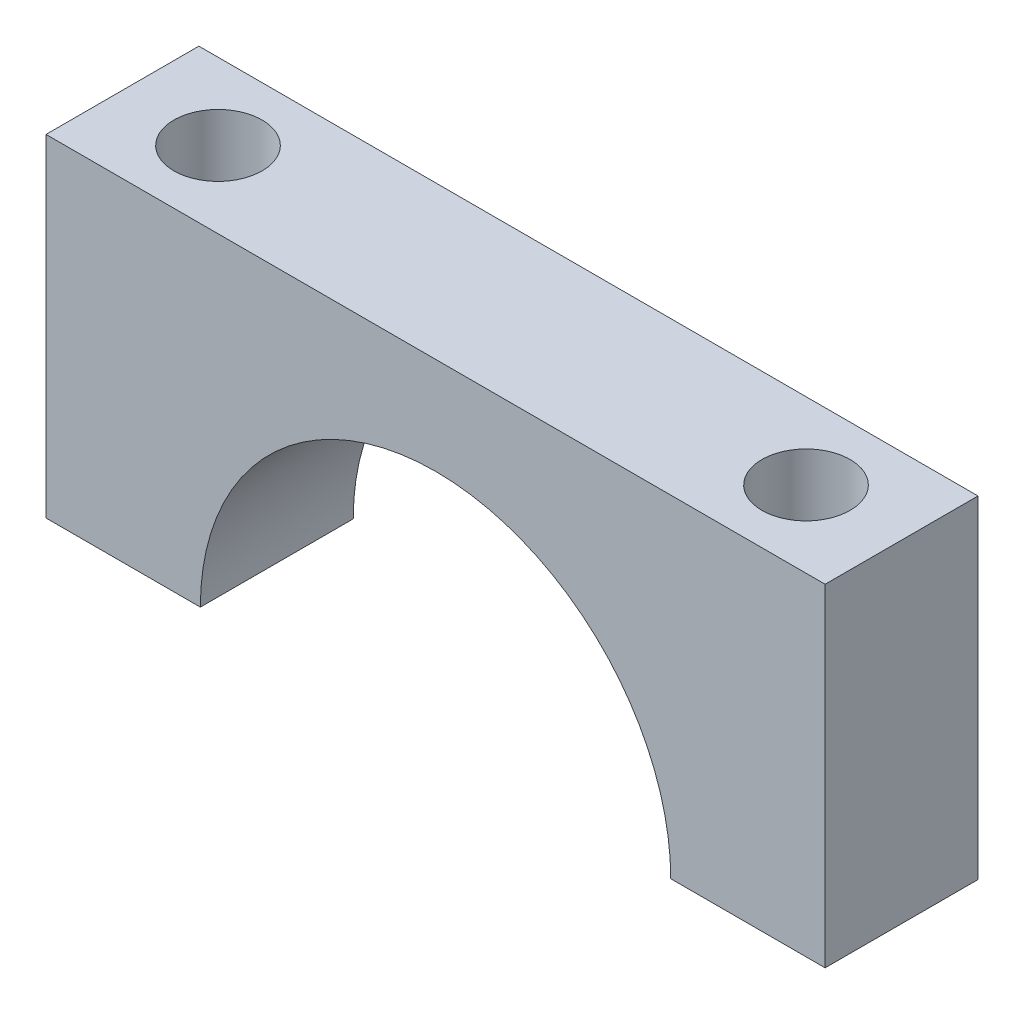
from build123d import *

# Parameters (mm, degrees)
BOSS_EXTRUDE1_DEPTH = 2.6
SKETCH2_R           = 1.5
CUT_EXTRUDE1_DEPTH  = 18.607171834


with BuildPart() as part:
    # Sketch1 → Boss-Extrude1 (new, symmetric)
    with BuildSketch(Plane.XY):
        with BuildLine():
            Line((8, 0), (13.25, 0))
            Line((13.25, 0), (13.25, 11.3))
            Line((13.25, 11.3), (-13.25, 11.3))
            Line((-13.25, 11.3), (-13.25, 0))
            Line((-13.25, 0), (-8, 0))
            ThreePointArc((-8, 0), (0, 8), (8, 0))
        make_face()
    extrude(amount=BOSS_EXTRUDE1_DEPTH, both=True)

    # Sketch2 → Cut-Extrude1 (cut, through all)
    with BuildSketch(Plane(origin=(0, 11.3, 0), x_dir=(1, 0, 0), z_dir=(0, 1, 0))):
        with Locations(Location((-10, 0, 0), (0, 0, 270))):
            Circle(SKETCH2_R)
        with Locations(Location((10, 0, 0), (0, 0, 270))):
            Circle(SKETCH2_R)
    extrude(amount=-CUT_EXTRUDE1_DEPTH, mode=Mode.SUBTRACT)


solid = part.part
